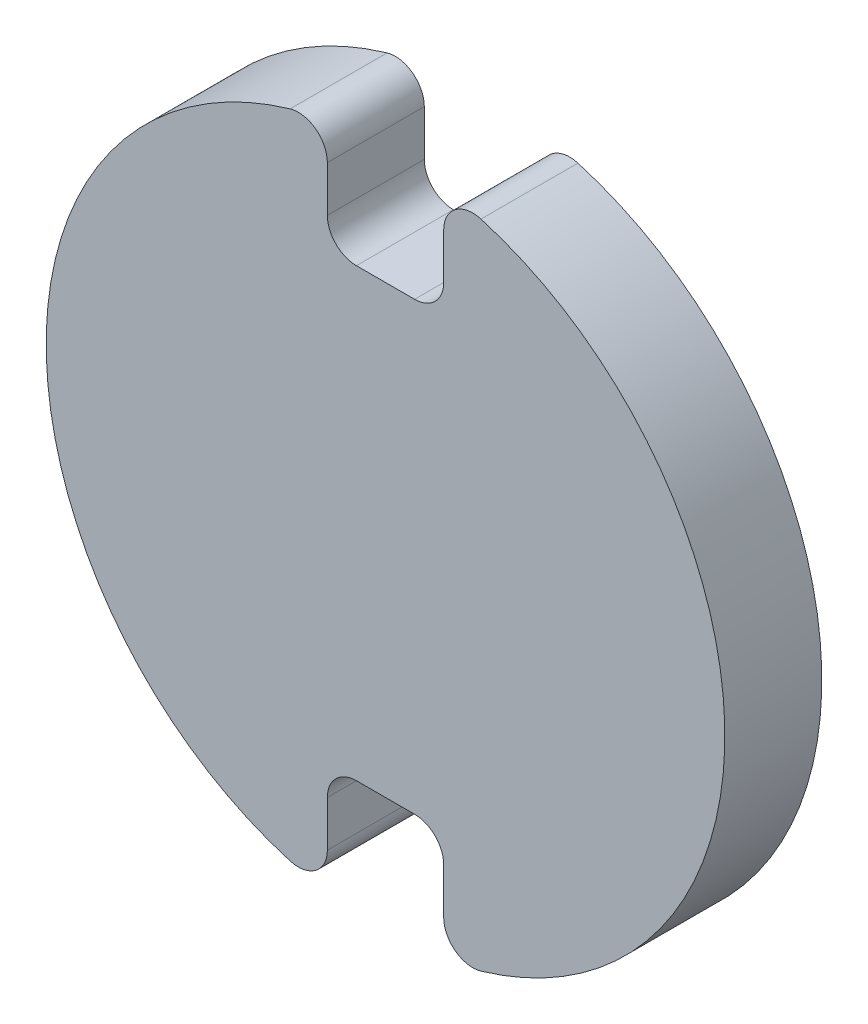
from build123d import *

# Parameters (mm, degrees)
IZIM1_R                     = 35
Y_KSEKLIK_EKSTR_ZYON1_DEPTH = 10
IZIM2_W                     = 12
IZIM2_H                     = 12
KES_EKSTR_ZYON1_DEPTH       = 16
RADYUS1_R                   = 3


with BuildPart() as part:
    # Çizim1 → Yükseklik-Ekstrüzyon1 (new body)
    with BuildSketch(Plane.XY):
        Circle(IZIM1_R)
    extrude(amount=Y_KSEKLIK_EKSTR_ZYON1_DEPTH)

    # Çizim2 → Kes-Ekstrüzyon1 (cut)
    with BuildSketch(Plane(origin=(0, 0, 0), x_dir=(-1, 0, 0), z_dir=(0, 0, -1))):
        with Locations((0, 29)):
            Rectangle(IZIM2_W, IZIM2_H)
        with Locations((0, -29)):
            Rectangle(IZIM2_W, IZIM2_H)
    extrude(amount=-KES_EKSTR_ZYON1_DEPTH, mode=Mode.SUBTRACT)

    # Radyus1
    radyus1_edges = [part.edges().sort_by_distance(p)[0] for p in [
        (-6, 34.481879299, 5),
        (6, 34.481879299, 5),
        (6, 23, 5),
        (-6, 23, 5),
        (-6, -34.481879299, 5),
        (-6, -23, 5),
        (6, -34.481879299, 5),
        (6, -23, 5),
    ]]
    fillet(radyus1_edges, radius=RADYUS1_R)


solid = part.part
